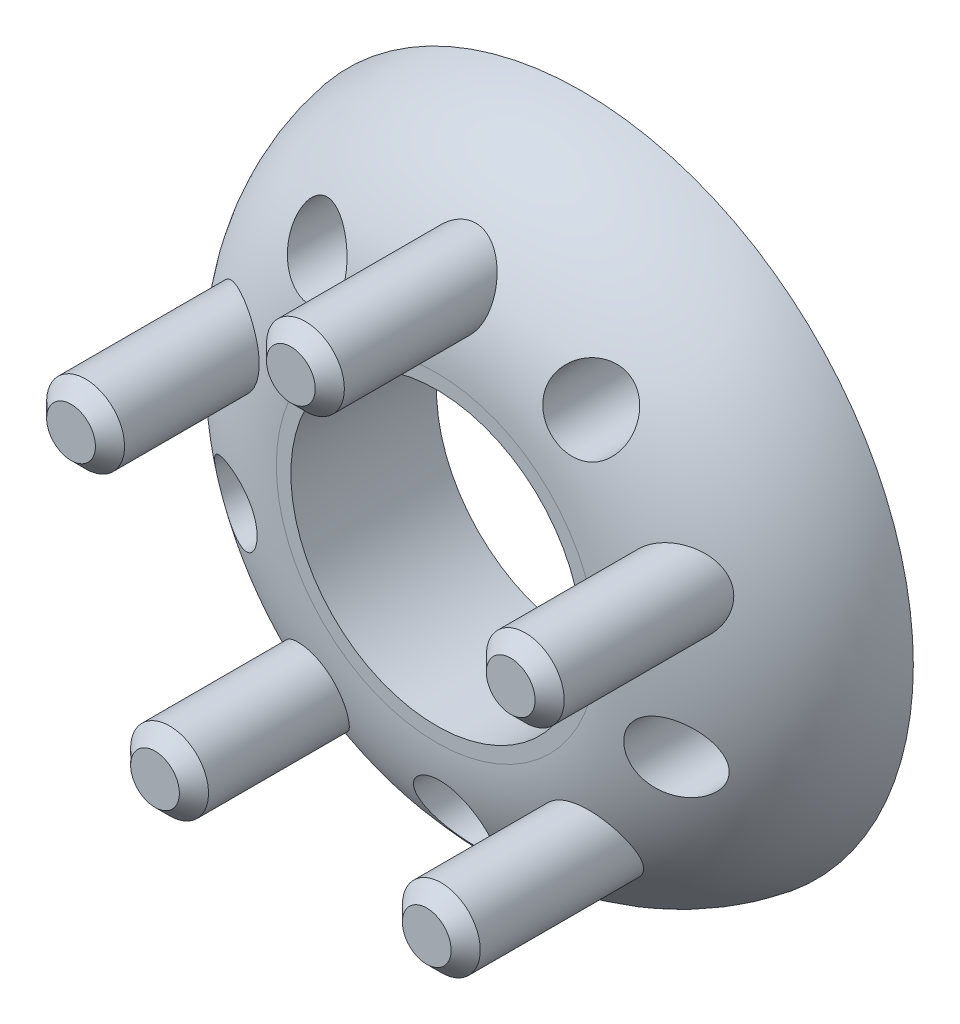
from build123d import *

# Parameters (mm, degrees)
SKETCH8_R                           = 2.675
BOSS_EXTRUDE3_DEPTH                 = 20
CHAMFER1_SIZE                       = 1
SKETCH9_R                           = 2.5
CUT_EXTRUDE_2_DEPTH                 = 38.884864962
SKETCH_3_R                          = 10
CUT_EXTRUDE_3_DEPTH                 = 34.693663962
PATTERN_CIRCULAR_2_COUNT            = 5
CHAMFER1_OF_PATTERN_CIRCULAR_2_SIZE = 1


with BuildPart() as part:
    # 스케치2 → 회전1 (revolve)
    with BuildSketch(Plane(origin=(0, 0, 0), x_dir=(0, 0, -1), z_dir=(1, 0, 0))):
        with BuildLine():
            Line((0, 0), (0, 11))
            ThreePointArc((0, 11), (2.838359948, 18.715214406), (10, 22.751516214))
            Line((10, 22.751516214), (10, 0))
            Line((10, 0), (0, 0))
        make_face()
    revolve(axis=Axis((0, 0, -10), (0, 0, 1)))

    # Sketch8 → Boss-Extrude3 (add)
    with BuildSketch(Plane(origin=(0, 0, -10), x_dir=(-1, 0, 0), z_dir=(0, 0, -1))):
        with Locations(Location((0, 15.875, 0), (0, 0, 90.000000161))):
            Circle(SKETCH8_R)
    boss_extrude3 = extrude(amount=-BOSS_EXTRUDE3_DEPTH)

    # Chamfer1
    chamfer1_edges = [part.edges().sort_by_distance(p)[0] for p in [
        (-8e-09, 13.2, 10),
    ]]
    chamfer(chamfer1_edges, length=CHAMFER1_SIZE)

    # Sketch9 → 컷-돌출2 (cut, through all)
    with BuildSketch(Plane.XY.offset(10)):
        with Locations((0, -15.875)):
            Circle(SKETCH9_R)
    cut_extrude_2 = extrude(amount=-CUT_EXTRUDE_2_DEPTH, mode=Mode.SUBTRACT)

    # 스케치3 → 컷-돌출3 (cut, through all)
    with BuildSketch(Plane.XY):
        Circle(SKETCH_3_R)
    extrude(amount=-CUT_EXTRUDE_3_DEPTH, mode=Mode.SUBTRACT)

    # 원형 패턴2: Boss-Extrude3, 컷-돌출2 ×5 about axis
    pattern_circular_2_axis = Axis((0, 0, 0), (0, 0, 1))
    add([boss_extrude3.rotate(pattern_circular_2_axis, i * 360 / PATTERN_CIRCULAR_2_COUNT) for i in range(1, PATTERN_CIRCULAR_2_COUNT)])
    add([cut_extrude_2.rotate(pattern_circular_2_axis, i * 360 / PATTERN_CIRCULAR_2_COUNT) for i in range(1, PATTERN_CIRCULAR_2_COUNT)], mode=Mode.SUBTRACT)

    # Chamfer1 of 원형 패턴2
    chamfer1_of_pattern_circular_2_edges = [part.edges().sort_by_distance(p)[0] for p in [
        (-12.553946017, 4.079024319, 10),
        (-7.758765324, -10.67902433, 10),
        (7.758765336, -10.679024321, 10),
        (12.553946013, 4.079024333, 10),
    ]]
    chamfer(chamfer1_of_pattern_circular_2_edges, length=CHAMFER1_OF_PATTERN_CIRCULAR_2_SIZE)


solid = part.part
